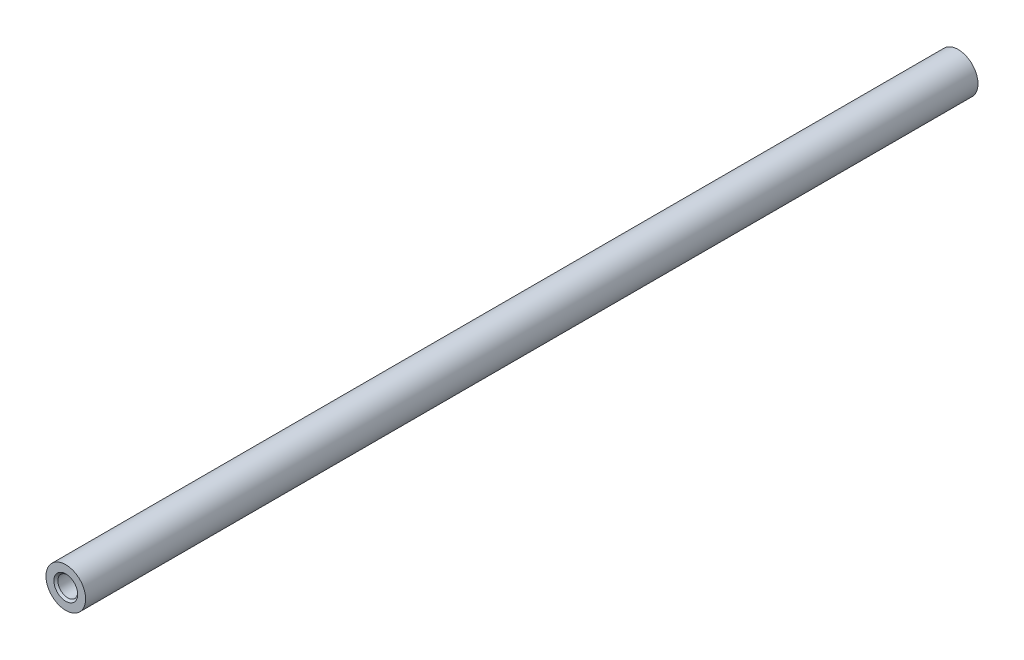
from build123d import *

# Parameters (mm, degrees)
SKETCH_2_R      = 10
SKETCH_2_R_2    = 5
EXTRUDE_1_DEPTH = 450
CHAMFER_1_SIZE  = 1


with BuildPart() as part:
    # 스케치2 → 보스-돌출1 (new body)
    with BuildSketch(Plane.XY):
        Circle(SKETCH_2_R)
        Circle(SKETCH_2_R_2, mode=Mode.SUBTRACT)
    extrude(amount=EXTRUDE_1_DEPTH)

    # 모따기1
    chamfer_1_edges = [part.edges().sort_by_distance(p)[0] for p in [
        (-5, 0, 450),
    ]]
    chamfer(chamfer_1_edges, length=CHAMFER_1_SIZE)


solid = part.part
